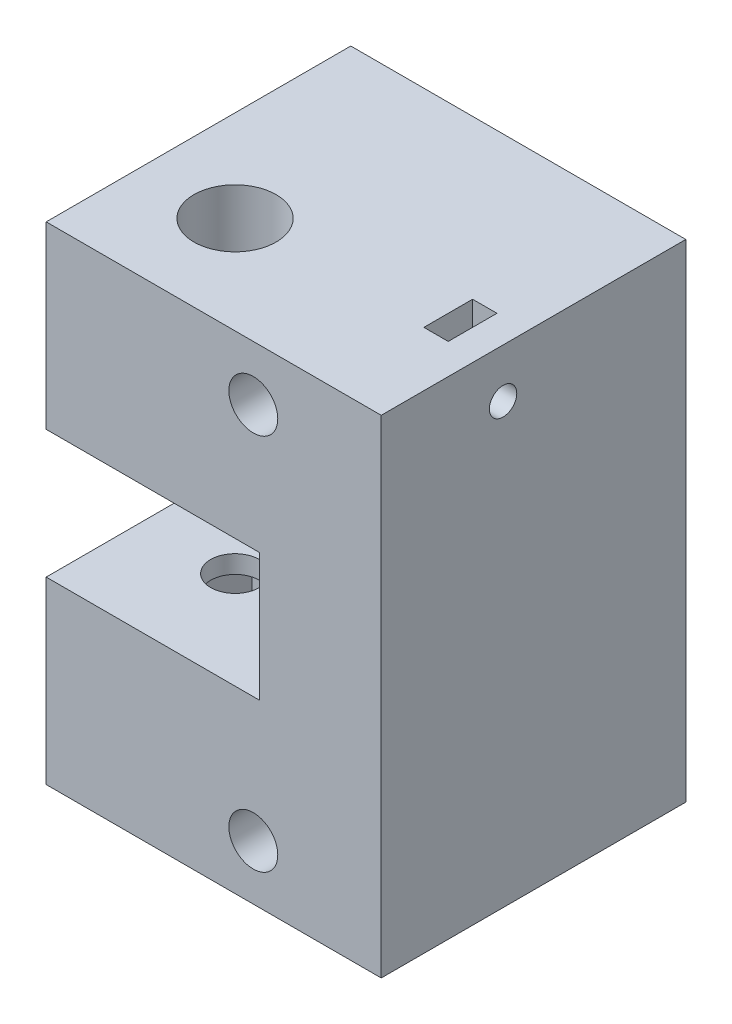
from build123d import *

# Parameters (mm, degrees)
SKETCH1_W           = 55
SKETCH1_H           = 80
BOSS_EXTRUDE1_DEPTH = 50
SKETCH2_R           = 4
CUT_EXTRUDE1_DEPTH  = 110.201648339
SKETCH3_R           = 4.015
CUT_EXTRUDE2_DEPTH  = 8.03
SKETCH4_W           = 35
SKETCH4_H           = 21
CUT_EXTRUDE3_DEPTH  = 35
SKETCH8_R           = 6.75
CUT_EXTRUDE5_DEPTH  = 26.55
CUT_EXTRUDE6_DEPTH  = 26.55
SKETCH10_R          = 2
CUT_EXTRUDE7_DEPTH  = 5
SKETCH12_R          = 2.1
CUT_EXTRUDE8_DEPTH  = 104.198837203
SKETCH12_3_R        = 3.75
CUT_EXTRUDE9_DEPTH  = 4.5
SKETCH13_R          = 2.25
CUT_EXTRUDE10_DEPTH = 10
SKETCH14_W          = 4
SKETCH14_H          = 8
CUT_EXTRUDE11_DEPTH = 13
CUT_EXTRUDE12_DEPTH = 0.5


with BuildPart() as part:
    # Sketch1 → Boss-Extrude1 (new body)
    with BuildSketch(Plane.XY):
        with Locations((-27.5, 40)):
            Rectangle(SKETCH1_W, SKETCH1_H)
    extrude(amount=BOSS_EXTRUDE1_DEPTH)

    # Sketch2 → Cut-Extrude1 (cut, through all)
    with BuildSketch(Plane(origin=(0, 80, 0), x_dir=(1, 0, 0), z_dir=(0, 1, 0))):
        with Locations(Location((-40, -34, 0), (0, 0, 180))):
            Circle(SKETCH2_R)
    extrude(amount=-CUT_EXTRUDE1_DEPTH, mode=Mode.SUBTRACT)

    # Sketch3 → Cut-Extrude2 (cut)
    with BuildSketch(Plane.XY.offset(50)):
        with Locations((-21, 71)):
            Circle(SKETCH3_R)
        with Locations((-21, 9)):
            Circle(SKETCH3_R)
    extrude(amount=-CUT_EXTRUDE2_DEPTH, mode=Mode.SUBTRACT)

    # Sketch4 → Cut-Extrude3 (cut)
    with BuildSketch(Plane.XY.offset(50)):
        with Locations((-37.5, 40)):
            Rectangle(SKETCH4_W, SKETCH4_H)
    extrude(amount=-CUT_EXTRUDE3_DEPTH, mode=Mode.SUBTRACT)

    # Sketch8 → Cut-Extrude5 (cut)
    with BuildSketch(Plane(origin=(0, 80, 0), x_dir=(1, 0, 0), z_dir=(0, 1, 0))):
        with Locations(Location((-40, -34, 0), (0, 0, 180))):
            Circle(SKETCH8_R)
    extrude(amount=-CUT_EXTRUDE5_DEPTH, mode=Mode.SUBTRACT)

    # Sketch9 → Cut-Extrude6 (cut)
    with BuildSketch(Plane.XZ):
        Polygon((-32.436711474, 34), (-36.218355737, 40.55), (-43.781644263, 40.55), (-47.563288526, 34), (-43.781644263, 27.45), (-36.218355737, 27.45), align=None)
    extrude(amount=-CUT_EXTRUDE6_DEPTH, mode=Mode.SUBTRACT)

    # Sketch10 → Cut-Extrude7 (cut)
    with BuildSketch(Plane.XZ):
        with Locations(Location((-12.5, 7.5, 0), (0, 0, 270))):
            Circle(SKETCH10_R)
        with Locations(Location((-12.5, 22.5, 0), (0, 0, 270))):
            Circle(SKETCH10_R)
    extrude(amount=-CUT_EXTRUDE7_DEPTH, mode=Mode.SUBTRACT)

    # Sketch12 → Cut-Extrude8 (cut, through all)
    with BuildSketch(Plane.XY.offset(15)):
        with Locations((-47.5, 40)):
            Circle(SKETCH12_R)
        with BuildLine():
            ThreePointArc((-29.6, 40), (-27.5, 37.9), (-25.4, 40))
            Line((-25.4, 40), (-29.6, 40))
        make_face()
        with BuildLine():
            Line((-29.6, 40), (-25.4, 40))
            ThreePointArc((-25.4, 40), (-27.5, 42.1), (-29.6, 40))
        make_face()
    extrude(amount=-CUT_EXTRUDE8_DEPTH, mode=Mode.SUBTRACT)

    # Sketch12<3> → Cut-Extrude9 (cut)
    with BuildSketch(Plane.XY.offset(15)):
        with BuildLine():
            ThreePointArc((-31.25, 40), (-27.5, 36.25), (-23.75, 40))
            Line((-23.75, 40), (-25.4, 40))
            ThreePointArc((-25.4, 40), (-27.5, 37.9), (-29.6, 40))
            Line((-29.6, 40), (-31.25, 40))
        make_face()
        with BuildLine():
            Line((-25.4, 40), (-23.75, 40))
            ThreePointArc((-23.75, 40), (-27.5, 43.75), (-31.25, 40))
            Line((-31.25, 40), (-29.6, 40))
            ThreePointArc((-29.6, 40), (-27.5, 42.1), (-25.4, 40))
        make_face()
        with Locations((-47.5, 40)):
            Circle(SKETCH12_3_R)
    extrude(amount=-CUT_EXTRUDE9_DEPTH, mode=Mode.SUBTRACT)

    # Sketch13 → Cut-Extrude10 (cut)
    with BuildSketch(Plane(origin=(0, 0, 0), x_dir=(0, 0, -1), z_dir=(1, 0, 0))):
        with Locations((-30, 72)):
            Circle(SKETCH13_R)
    extrude(amount=-CUT_EXTRUDE10_DEPTH, mode=Mode.SUBTRACT)

    # Sketch14 → Cut-Extrude11 (cut)
    with BuildSketch(Plane(origin=(0, 80, 0), x_dir=(1, 0, 0), z_dir=(0, 1, 0))):
        with Locations((-7, -30)):
            Rectangle(SKETCH14_W, SKETCH14_H)
    extrude(amount=-CUT_EXTRUDE11_DEPTH, mode=Mode.SUBTRACT)

    # Sketch15 → Cut-Extrude12 (cut)
    with BuildSketch(Plane.ZY.offset(55)):
        Polygon((25.128205128, 75.25), (29.743589744, 65.25), (28.768028846, 65.25), (27.289663462, 68.455128205), (22.756410256, 68.455128205), (21.235977564, 65.25), (20.256410256, 65.25), (25, 75.25), align=None)
        Polygon((25.054086538, 73.30088141), (23.243189103, 69.480769231), (26.816907051, 69.480769231), align=None, mode=Mode.SUBTRACT)
    extrude(amount=-CUT_EXTRUDE12_DEPTH, mode=Mode.SUBTRACT)


solid = part.part
